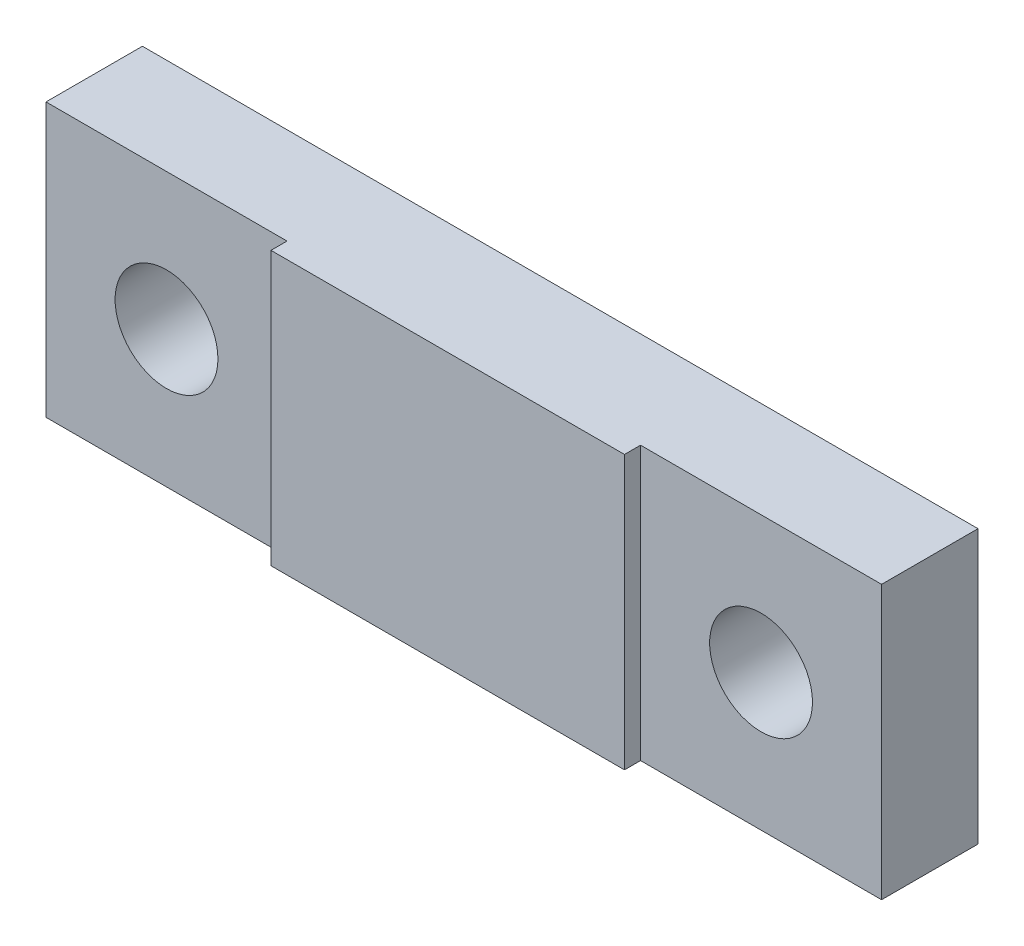
from build123d import *

# Parameters (mm, degrees)
ESQUISSE1_W        = 26
ESQUISSE1_H        = 8.5
ESQUISSE1_R        = 1.6
BOSS_EXTRU_1_DEPTH = 3
ESQUISSE2_W        = 11
ESQUISSE2_H        = 8.5
BOSS_EXTRU_2_DEPTH = 0.5


with BuildPart() as part:
    # Esquisse1 → Boss.-Extru.1 (new body)
    with BuildSketch(Plane.XY):
        with Locations((13, -4.25)):
            Rectangle(ESQUISSE1_W, ESQUISSE1_H)
        with Locations((3.75, -4.25)):
            Circle(ESQUISSE1_R, mode=Mode.SUBTRACT)
        with Locations((22.25, -4.25)):
            Circle(ESQUISSE1_R, mode=Mode.SUBTRACT)
    extrude(amount=BOSS_EXTRU_1_DEPTH)

    # Esquisse2 → Boss.-Extru.2 (add)
    with BuildSketch(Plane.XY.offset(3)):
        with Locations((13, -4.25)):
            Rectangle(ESQUISSE2_W, ESQUISSE2_H)
    extrude(amount=BOSS_EXTRU_2_DEPTH)


solid = part.part
